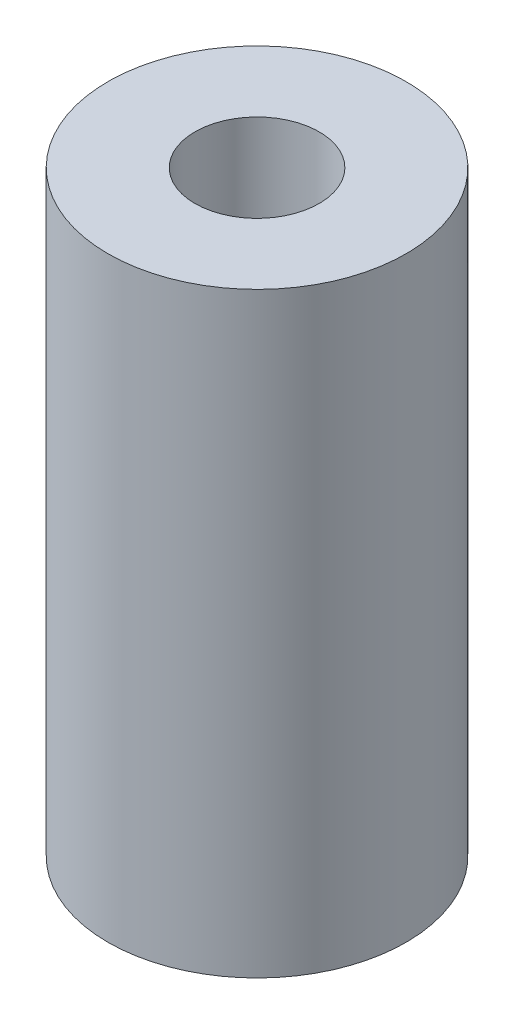
from build123d import *

# Parameters (mm, degrees)
SKETCH_1_R          = 6
EXTRUDE_1_DEPTH     = 24
SKETCH_2_R          = 2.5
CUT_EXTRUDE_1_DEPTH = 18
CUT_EXTRUDE_START   = -18
SKETCH_3_R          = 2.5
CUT_EXTRUDE_2_DEPTH = 18


with BuildPart() as part:
    # Эскиз1 → Бобышка-Вытянуть1 (new body)
    with BuildSketch(Plane(origin=(0, 0, 0), x_dir=(1, 0, 0), z_dir=(0, 1, 0))):
        with Locations(Location((0, 0, 0), (0, 0, 270))):
            Circle(SKETCH_1_R)
    extrude(amount=EXTRUDE_1_DEPTH)

    # Эскиз2 → Вырез-Вытянуть1 (cut)
    with BuildSketch(Plane(origin=(0, 24, 0), x_dir=(1, 0, 0), z_dir=(0, 1, 0))):
        with Locations(Location((0, 0, 0), (0, 0, 270))):
            Circle(SKETCH_2_R)
    extrude(amount=-CUT_EXTRUDE_1_DEPTH, mode=Mode.SUBTRACT)

    # Эскиз3 → Вырез-Вытянуть2 (cut)
    with BuildSketch(Plane.XZ.offset(CUT_EXTRUDE_START)):
        with Locations(Location((0, 0, 0), (0, 0, 90))):
            Circle(SKETCH_3_R)
    extrude(amount=CUT_EXTRUDE_2_DEPTH, mode=Mode.SUBTRACT)


solid = part.part
